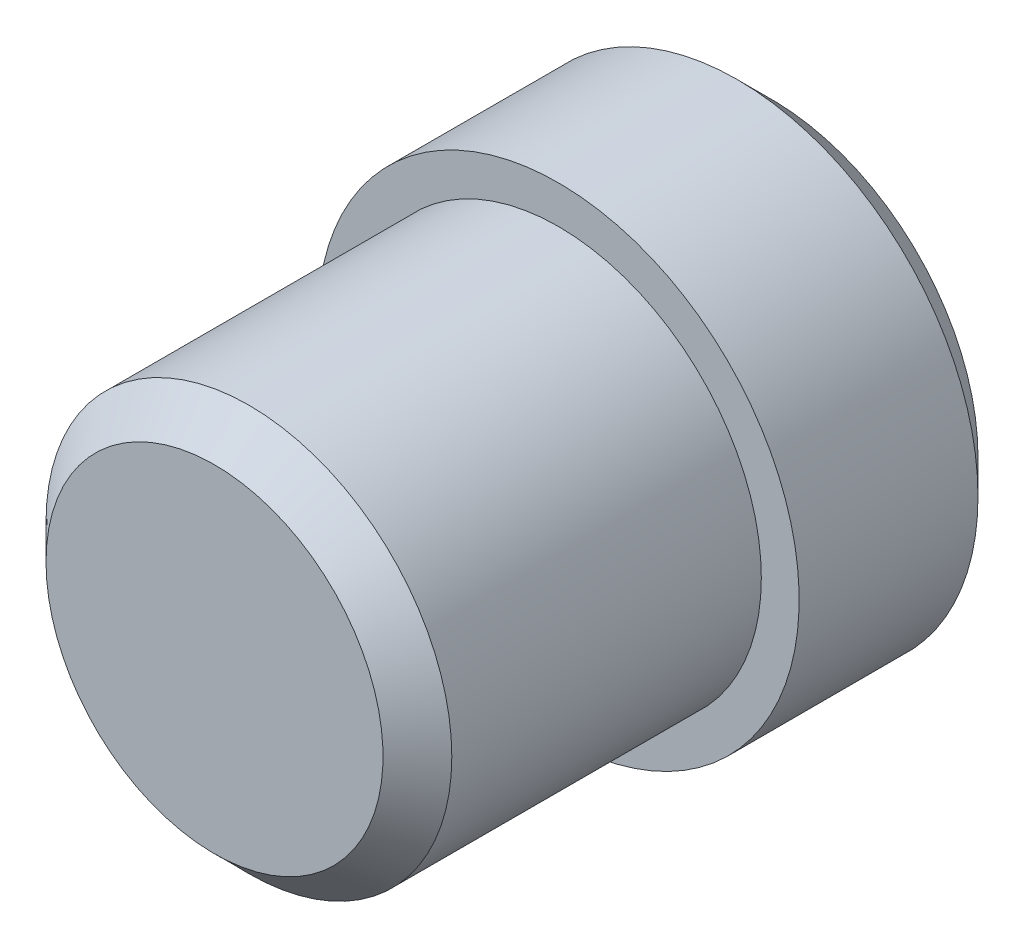
from build123d import *

# Parameters (mm, degrees)
SKETCH_1_R      = 3.5
EXTRUDE_1_DEPTH = 3.1
SKETCH_2_R      = 2.95
EXTRUDE_2_DEPTH = 5
CHAMFER_1_SIZE  = 0.5


with BuildPart() as part:
    # 草图1 → 拉伸1 (new body)
    with BuildSketch(Plane.XY):
        with Locations(Location((0, 0, 0), (0, 0, 180))):
            Circle(SKETCH_1_R)
    extrude(amount=EXTRUDE_1_DEPTH)

    # 草图2 → 拉伸2 (add)
    with BuildSketch(Plane.XY.offset(3.1)):
        Circle(SKETCH_2_R)
    extrude(amount=EXTRUDE_2_DEPTH)

    # 倒角1
    chamfer_1_edges = [part.edges().sort_by_distance(p)[0] for p in [
        (3.5, 0, 0),
        (-2.95, 0, 8.1),
    ]]
    chamfer(chamfer_1_edges, length=CHAMFER_1_SIZE)


solid = part.part
